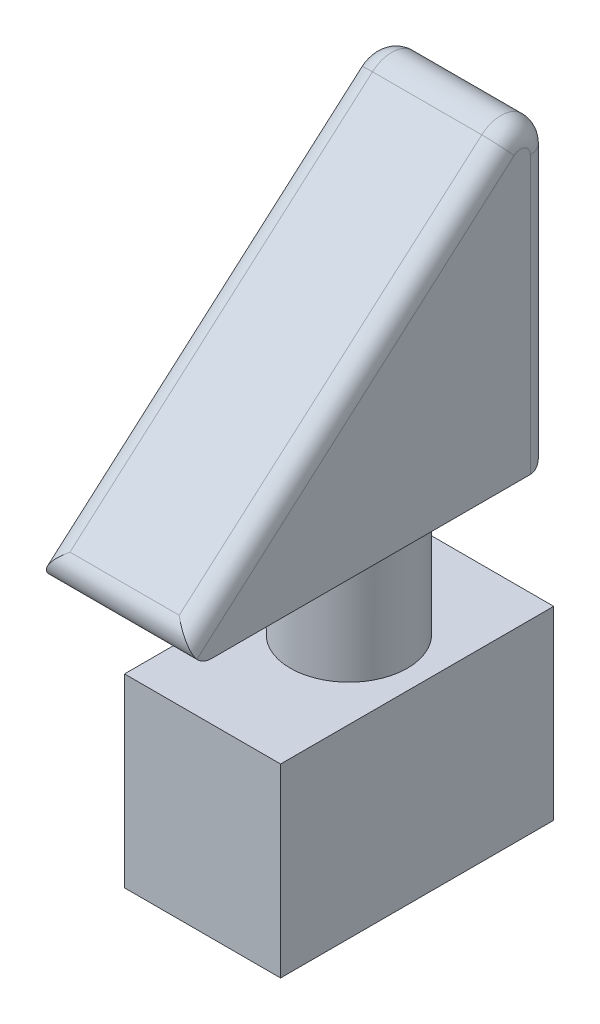
from build123d import *

# Parameters (mm, degrees)
BOSS_EXTRUDE1_DEPTH = 15.2
SKETCH2_R           = 6
BOSS_EXTRUDE2_DEPTH = 12.5
SKETCH3_W           = 16
SKETCH3_H           = 28
BOSS_EXTRUDE3_DEPTH = 19
FILLET1_R           = 3
FILLET2_R           = 2


with BuildPart() as part:
    # Sketch1 → Boss-Extrude1 (new body)
    with BuildSketch(Plane(origin=(0, 0, 0), x_dir=(0, 0, -1), z_dir=(1, 0, 0))):
        Polygon((0, 0), (-40, 0), (0, 35), align=None)
    extrude(amount=BOSS_EXTRUDE1_DEPTH)

    # Sketch2 → Boss-Extrude2 (add)
    with BuildSketch(Plane.XZ):
        with Locations(Location((7.6, 13, 0), (0, 0, 90))):
            Circle(SKETCH2_R)
    extrude(amount=BOSS_EXTRUDE2_DEPTH)

    # Sketch3 → Boss-Extrude3 (add)
    with BuildSketch(Plane.XZ.offset(12.5)):
        with Locations((7.6, 14)):
            Rectangle(SKETCH3_W, SKETCH3_H)
    extrude(amount=BOSS_EXTRUDE3_DEPTH)

    # Fillet1
    fillet1_edges = [part.edges().sort_by_distance(p)[0] for p in [
        (7.6, 35, 0),
    ]]
    fillet(fillet1_edges, radius=FILLET1_R)

    # Fillet2
    fillet2_edges = [part.edges().sort_by_distance(p)[0] for p in [
        (0, 15.323212702, 22.487756912),
        (15.2, 15.323212702, 22.487756912),
        (0, 31.120594062, 1.760351153),
        (15.2, 31.120594062, 1.760351153),
        (15.2, 14.19434766, 0),
        (0, 14.19434766, 0),
        (7.6, 0, 0),
        (7.6, 0, 40),
    ]]
    fillet(fillet2_edges, radius=FILLET2_R)


solid = part.part
